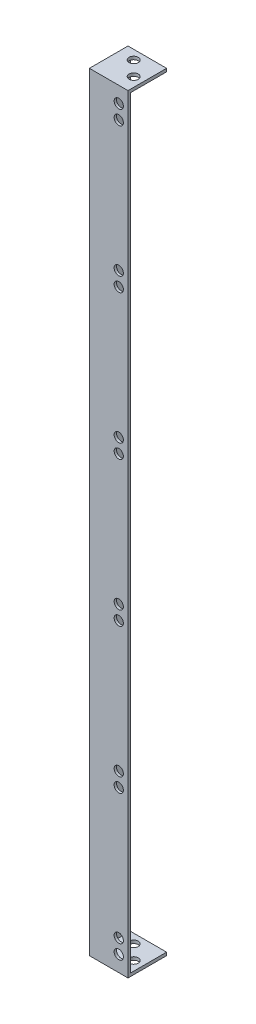
from build123d import *

# Parameters (mm, degrees)
BOSS_EXTRUDE1_DEPTH = 327
SKETCH2_R           = 1.95
CUT_EXTRUDE1_DEPTH  = 2
SKETCH3_R           = 1.95
CUT_EXTRUDE2_DEPTH  = 2
SKETCH5_W           = 16.3
SKETCH5_H           = 1.3
CUT_EXTRUDE4_DEPTH  = 20
SKETCH6_W           = 16.3
SKETCH6_H           = 16.3
BOSS_EXTRUDE3_DEPTH = 1.3
SKETCH7_W           = 16.3
SKETCH7_H           = 16.3
BOSS_EXTRUDE4_DEPTH = 1.3
SKETCH8_R           = 1.95
CUT_EXTRUDE7_DEPTH  = 350


with BuildPart() as part:
    # Sketch1 → Boss-Extrude1 (new body)
    with BuildSketch(Plane(origin=(0, 0, 0), x_dir=(1, 0, 0), z_dir=(0, 1, 0))):
        Polygon((0, 0), (0, 16.3), (1, 16.3), (1, 1), (16.3, 1), (16.3, 0), align=None)
    extrude(amount=BOSS_EXTRUDE1_DEPTH)

    # Sketch2 → Cut-Extrude1 (cut)
    with BuildSketch(Plane.XY):
        with Locations((12.4, 197)):
            Circle(SKETCH2_R)
        with Locations((12.4, 191)):
            Circle(SKETCH2_R)
        with Locations((12.4, 136)):
            Circle(SKETCH2_R)
        with Locations((12.4, 130)):
            Circle(SKETCH2_R)
        with Locations((12.4, 75)):
            Circle(SKETCH2_R)
        with Locations((12.4, 69)):
            Circle(SKETCH2_R)
        with Locations((12.4, 14)):
            Circle(SKETCH2_R)
        with Locations((12.4, 8)):
            Circle(SKETCH2_R)
        with Locations((12.4, 319)):
            Circle(SKETCH2_R)
        with Locations((12.4, 313)):
            Circle(SKETCH2_R)
        with Locations((12.4, 258)):
            Circle(SKETCH2_R)
        with Locations((12.4, 252)):
            Circle(SKETCH2_R)
    extrude(amount=-CUT_EXTRUDE1_DEPTH, mode=Mode.SUBTRACT)

    # Sketch3 → Cut-Extrude2 (cut)
    with BuildSketch(Plane.ZY):
        with Locations((-12.4, 313)):
            Circle(SKETCH3_R)
        with Locations((-12.4, 258)):
            Circle(SKETCH3_R)
        with Locations((-12.4, 252)):
            Circle(SKETCH3_R)
        with Locations((-12.4, 197)):
            Circle(SKETCH3_R)
        with Locations((-12.4, 191)):
            Circle(SKETCH3_R)
        with Locations((-12.4, 136)):
            Circle(SKETCH3_R)
        with Locations((-12.4, 130)):
            Circle(SKETCH3_R)
        with Locations((-12.4, 75)):
            Circle(SKETCH3_R)
        with Locations((-12.4, 69)):
            Circle(SKETCH3_R)
        with Locations((-12.4, 8)):
            Circle(SKETCH3_R)
        with Locations((-12.4, 14)):
            Circle(SKETCH3_R)
        with Locations((-12.4, 319)):
            Circle(SKETCH3_R)
    extrude(amount=-CUT_EXTRUDE2_DEPTH, mode=Mode.SUBTRACT)

    # Sketch5 → Cut-Extrude4 (cut)
    with BuildSketch(Plane.ZY):
        with Locations((-8.15, 0.65)):
            Rectangle(SKETCH5_W, SKETCH5_H)
        with Locations((-8.15, 326.35)):
            Rectangle(SKETCH5_W, SKETCH5_H)
    extrude(amount=-CUT_EXTRUDE4_DEPTH, mode=Mode.SUBTRACT)

    # Sketch6 → Boss-Extrude3 (add)
    with BuildSketch(Plane(origin=(0, 325.7, 0), x_dir=(1, 0, 0), z_dir=(0, 1, 0))):
        with Locations((8.15, 8.15)):
            Rectangle(SKETCH6_W, SKETCH6_H)
    extrude(amount=-BOSS_EXTRUDE3_DEPTH)

    # Sketch7 → Boss-Extrude4 (add)
    with BuildSketch(Plane.XZ.offset(-1.3)):
        with Locations((8.15, -8.15)):
            Rectangle(SKETCH7_W, SKETCH7_H)
    extrude(amount=-BOSS_EXTRUDE4_DEPTH)

    # Sketch8 → Cut-Extrude7 (cut)
    with BuildSketch(Plane.XZ.offset(-1.3)):
        with Locations(Location((12.4, -6.3, 0), (0, 0, 270))):
            Circle(SKETCH8_R)
        with Locations(Location((6.3, -12.4, 0), (0, 0, 270))):
            Circle(SKETCH8_R)
    extrude(amount=-CUT_EXTRUDE7_DEPTH, mode=Mode.SUBTRACT)


solid = part.part
